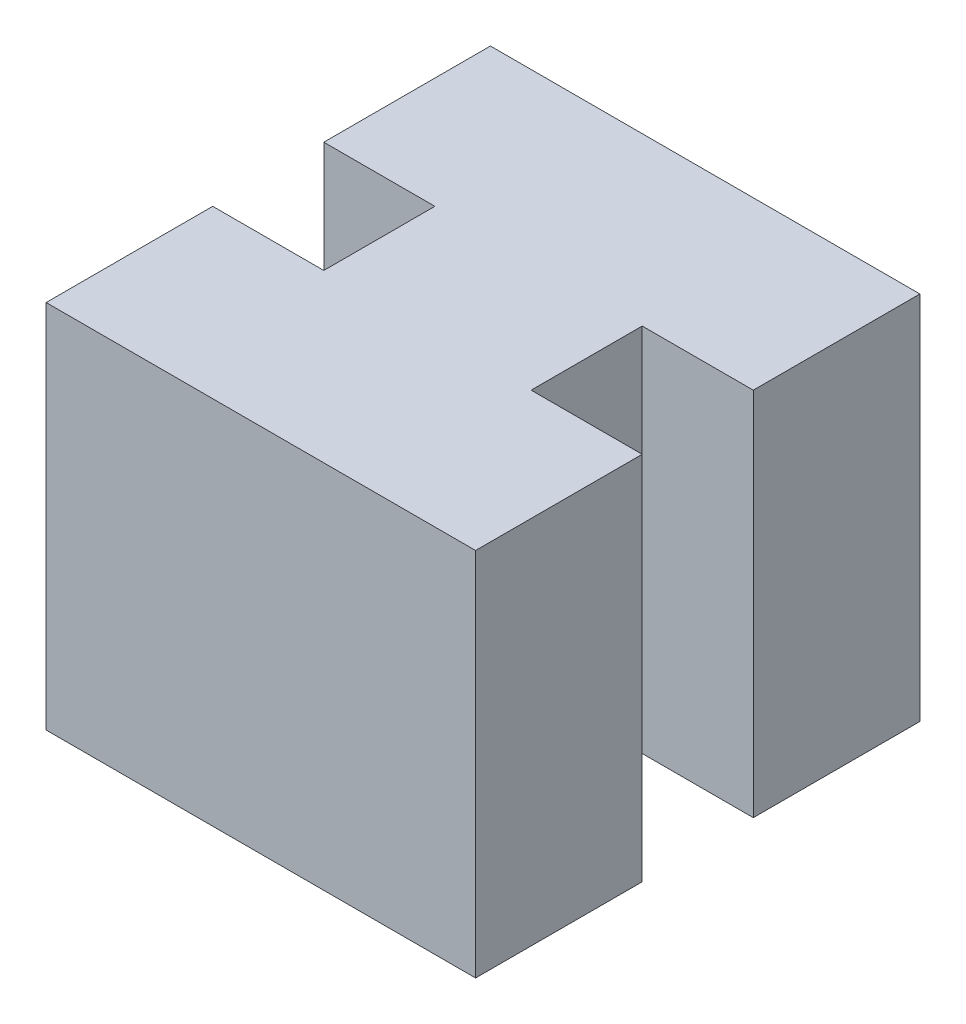
from build123d import *

# Parameters (mm, degrees)
BOSS_EXTRUDE1_DEPTH = 2.5


with BuildPart() as part:
    # Sketch1 → Boss-Extrude1 (new, symmetric)
    with BuildSketch(Plane(origin=(0, 0, 0), x_dir=(1, 0, 0), z_dir=(0, 1, 0))):
        Polygon((2.9, 3), (-2.9, 3), (-2.9, 0.75), (-1.4, 0.75), (-1.4, -0.75), (-2.9, -0.75), (-2.9, -3), (2.9, -3), (2.9, -0.75), (1.4, -0.75), (1.4, 0.75), (2.9, 0.75), align=None)
    extrude(amount=BOSS_EXTRUDE1_DEPTH, both=True)


solid = part.part
